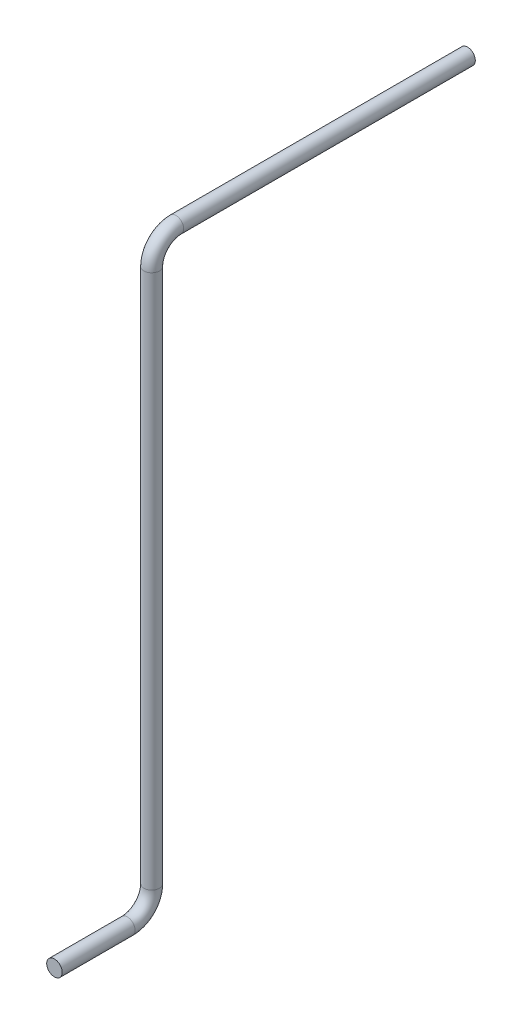
from build123d import *

# Parameters (mm, degrees)
SKETCH1_R = 1.6


with BuildPart() as part:
    # Sweep1: sweep along a path in Sketch2
    with BuildLine(Plane(origin=(0, 0, 0), x_dir=(0, 0, -1), z_dir=(1, 0, 0))) as sweep1_path:
        Line((0, 0), (15, 0))
        ThreePointArc((15, 0), (18.535533906, 1.464466094), (20, 5))
        Line((20, 5), (20, 115))
        ThreePointArc((20, 115), (21.464466094, 118.535533906), (25, 120))
        Line((25, 120), (85, 120))
    # Sketch1 → Sweep1 (sweep)
    with BuildSketch(Plane.XY):
        Circle(SKETCH1_R)
    sweep(path=sweep1_path.line)


solid = part.part
